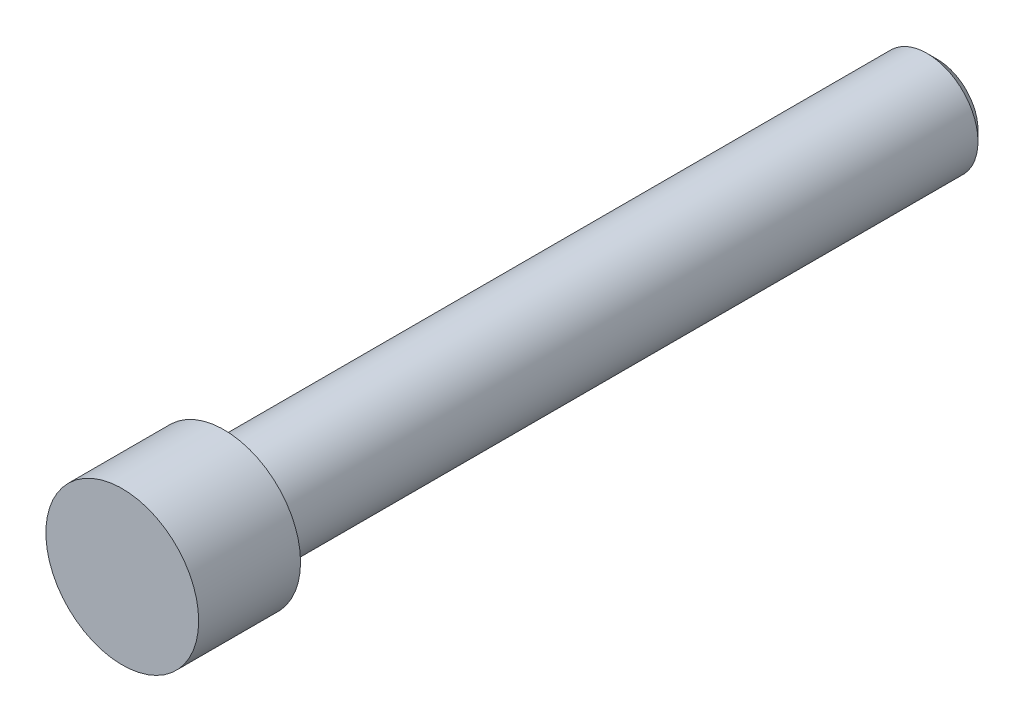
from build123d import *

# Parameters (mm, degrees)
CROQUIS1_R              = 1
SALIENTE_EXTRUIR1_DEPTH = 14
CROQUIS2_R              = 1.5
SALIENTE_EXTRUIR2_DEPTH = 2
CHAFL_N1_SIZE           = 0.2


with BuildPart() as part:
    # Croquis1 → Saliente-Extruir1 (new body)
    with BuildSketch(Plane.XY):
        Circle(CROQUIS1_R)
    extrude(amount=SALIENTE_EXTRUIR1_DEPTH)

    # Croquis2 → Saliente-Extruir2 (add)
    with BuildSketch(Plane.XY.offset(14)):
        Circle(CROQUIS2_R)
    extrude(amount=SALIENTE_EXTRUIR2_DEPTH)

    # Chaflán1
    chafl_n1_edges = [part.edges().sort_by_distance(p)[0] for p in [
        (-1, 0, 0),
    ]]
    chamfer(chafl_n1_edges, length=CHAFL_N1_SIZE)


solid = part.part
